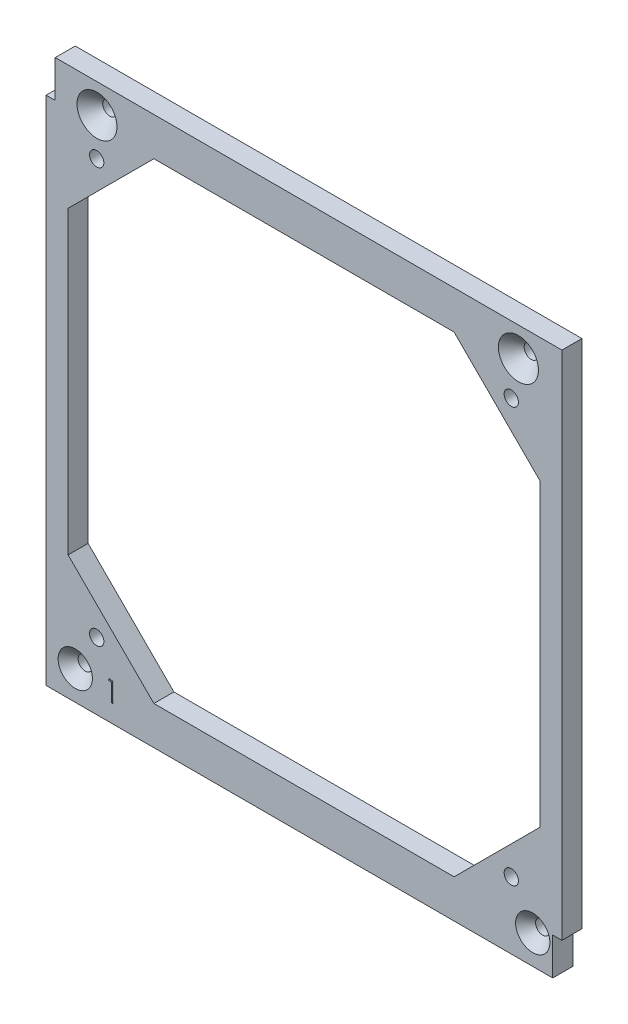
from build123d import *

# Parameters (mm, degrees)
ESBO_O1_W                  = 90.2
ESBO_O1_H                  = 95.9
RESSALTO_EXTRUS_O1_DEPTH   = 3.5
ESBO_O2_R                  = 1.25
CORTE_EXTRUS_O1_DEPTH      = 5
CORTE_EXTRUS_O3_DEPTH      = 5
ESBO_O4_R                  = 1.25
CORTE_EXTRUS_O2_DEPTH      = 10
CHANFRO4_SIZE              = 1.75
CHANFRO5_SIZE              = 1.75
CHANFRO6_SIZE              = 2.25
CHANFRO7_SIZE              = 2.25
CORTE_EXTRUS_O4_DEPTH      = 0.2
CORTE_EXTRUS_O5_DEPTH      = 0.2
CORTE_EXTRUS_O7_DEPTH      = 66.920122118
CORTE_EXTRUS_O7_DEPTH_BACK = 5
ESBO_O7_W                  = 1.6
ESBO_O7_H                  = 6.5
ESBO_O8_W                  = 1.6
ESBO_O8_H                  = 6.5
CORTE_EXTRUS_O8_DEPTH      = 5


with BuildPart() as part:
    # Esboço1 → Ressalto-extrusão1 (new body)
    with BuildSketch(Plane.XY):
        Rectangle(ESBO_O1_W, ESBO_O1_H)
    extrude(amount=RESSALTO_EXTRUS_O1_DEPTH)

    # Esboço2 → Corte-extrusão1 (cut)
    with BuildSketch(Plane.XY):
        with Locations((-36.2, 42.85)):
            Circle(ESBO_O2_R)
        with Locations((37.5, 42.85)):
            Circle(ESBO_O2_R)
        with Locations((40, -42.85)):
            Circle(ESBO_O2_R)
        with Locations((-40, -42.85)):
            Circle(ESBO_O2_R)
    extrude(amount=CORTE_EXTRUS_O1_DEPTH, mode=Mode.SUBTRACT)

    # Esboço3 → Corte-extrusão3 (cut)
    with BuildSketch(Plane.XY):
        Polygon((-26.25, 41.25), (26.25, 41.25), (41.25, 26.25), (41.25, -26.25), (26.25, -41.25), (-26.25, -41.25), (-41.25, -26.25), (-41.25, 26.25), align=None)
    extrude(amount=CORTE_EXTRUS_O3_DEPTH, mode=Mode.SUBTRACT)

    # Esboço4 → Corte-extrusão2 (cut)
    with BuildSketch(Plane.XY):
        with Locations((-36.25, 36.25)):
            Circle(ESBO_O4_R)
        with Locations((36.25, 36.25)):
            Circle(ESBO_O4_R)
        with Locations((-36.25, -36.25)):
            Circle(ESBO_O4_R)
        with Locations((36.25, -36.25)):
            Circle(ESBO_O4_R)
    extrude(amount=CORTE_EXTRUS_O2_DEPTH, mode=Mode.SUBTRACT)

    # Chanfro4
    chanfro4_edges = [part.edges().sort_by_distance(p)[0] for p in [
        (-41.25, -42.85, 3.5),
    ]]
    chamfer(chanfro4_edges, length=CHANFRO4_SIZE)

    # Chanfro5
    chanfro5_edges = [part.edges().sort_by_distance(p)[0] for p in [
        (38.75, -42.85, 3.5),
    ]]
    chamfer(chanfro5_edges, length=CHANFRO5_SIZE)

    # Chanfro6
    chanfro6_edges = [part.edges().sort_by_distance(p)[0] for p in [
        (-37.45, 42.85, 3.5),
    ]]
    chamfer(chanfro6_edges, length=CHANFRO6_SIZE)

    # Chanfro7
    chanfro7_edges = [part.edges().sort_by_distance(p)[0] for p in [
        (36.25, 42.85, 3.5),
    ]]
    chamfer(chanfro7_edges, length=CHANFRO7_SIZE)

    # Esboço5 → Corte-extrusão4 (cut)
    with BuildSketch(Plane.XY.offset(3.5)):
        Polygon((-34.011664728, -41.359633286), (-33.364529311, -41.359633286), (-33.364529311, -44.859633286), (-33.678631875, -44.859633286), (-33.678631875, -41.718607645), (-34.217093414, -41.718607645), align=None)
    extrude(amount=-CORTE_EXTRUS_O4_DEPTH, mode=Mode.SUBTRACT)

    # Esboço6 → Corte-extrusão5 (cut)
    with BuildSketch(Plane(origin=(0, 0, 0), x_dir=(-1, 0, 0), z_dir=(0, 0, -1))):
        Polygon((33.93825461, -40.504659527), (34.585390027, -40.504659527), (34.585390027, -44.004659527), (34.271287463, -44.004659527), (34.271287463, -40.863633886), (33.732825924, -40.863633886), align=None)
    extrude(amount=-CORTE_EXTRUS_O5_DEPTH, mode=Mode.SUBTRACT)

    # Esboço7 → Corte-extrusão7 (cut, two sides: drawn at the far end of the back side and taken through both)
    with BuildSketch(Plane(origin=(0, 0, 0), x_dir=(-1, 0, 0), z_dir=(0, 0, -1)).offset(-CORTE_EXTRUS_O7_DEPTH_BACK)):
        with Locations((-44.3, -44.7)):
            Rectangle(ESBO_O7_W, ESBO_O7_H)
    extrude(amount=CORTE_EXTRUS_O7_DEPTH + CORTE_EXTRUS_O7_DEPTH_BACK, mode=Mode.SUBTRACT)

    # Esboço8 → Corte-extrusão8 (cut)
    with BuildSketch(Plane.XY.offset(3.5)):
        with Locations((-44.3, 44.7)):
            Rectangle(ESBO_O8_W, ESBO_O8_H)
    extrude(amount=-CORTE_EXTRUS_O8_DEPTH, mode=Mode.SUBTRACT)


solid = part.part
